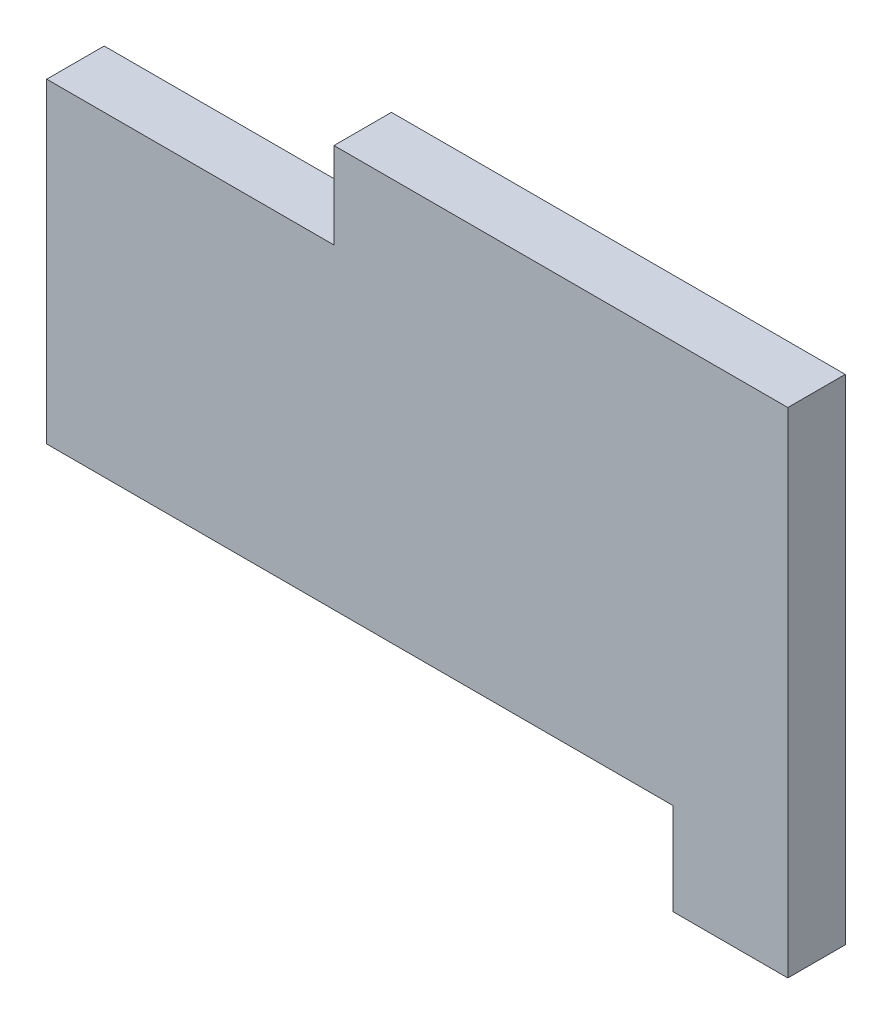
from build123d import *

# Parameters (mm, degrees)
BOSS_EXTRUDE1_DEPTH = 2.54


with BuildPart() as part:
    # Sketch1 → Boss-Extrude1 (new body)
    with BuildSketch(Plane.XY):
        Polygon((-16.163636364, 8.728363636), (-16.163636364, -5.241636364), (11.522363636, -5.241636364), (11.522363636, -9.305636364), (16.602363636, -9.305636364), (16.602363636, 12.538363636), (-3.463636364, 12.538363636), (-3.463636364, 8.728363636), align=None)
    extrude(amount=BOSS_EXTRUDE1_DEPTH)


solid = part.part
